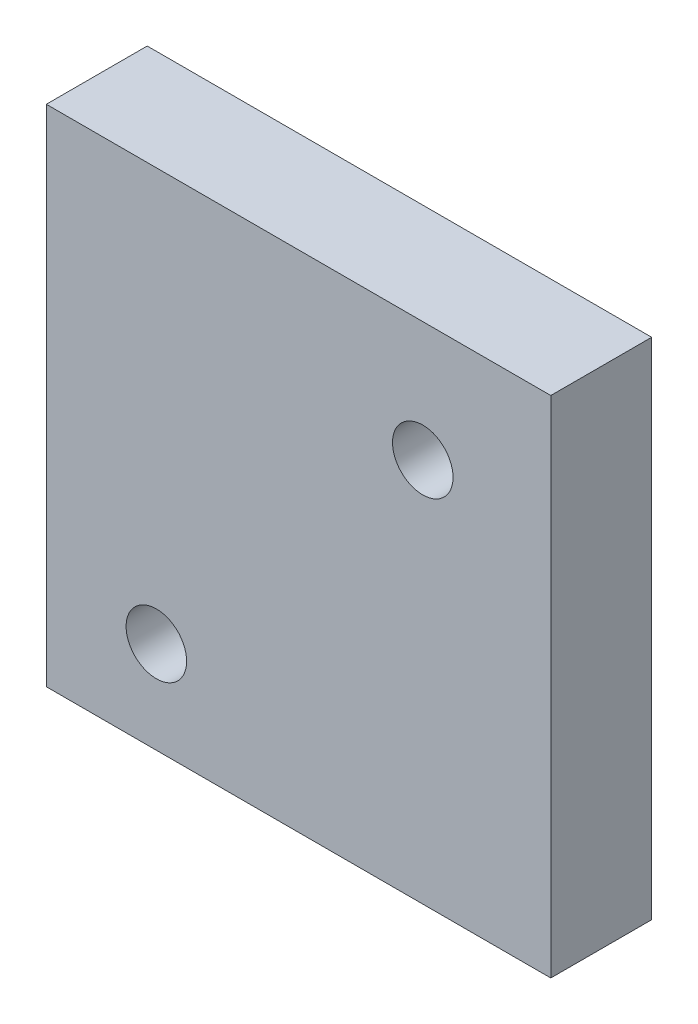
from build123d import *

# Parameters (mm, degrees)
SKETCH_1_W              = 100
SKETCH_1_H              = 100
EXTRUDE_1_DEPTH         = 20
HOLE_WIZARD_12_0_12_1_D = 12


with BuildPart() as part:
    # 草图1 → 凸台-拉伸1 (new body)
    with BuildSketch(Plane.XY):
        with Locations((50, 50)):
            Rectangle(SKETCH_1_W, SKETCH_1_H)
    extrude(amount=EXTRUDE_1_DEPTH)

    # Ø12.0 (12) 直径孔1 (through all)
    with Locations(Plane.XY.offset(20)):
        with Locations((74.623697629, 76.246353112), (21.812069899, 18.276104233)):
            Hole(HOLE_WIZARD_12_0_12_1_D / 2)


solid = part.part
